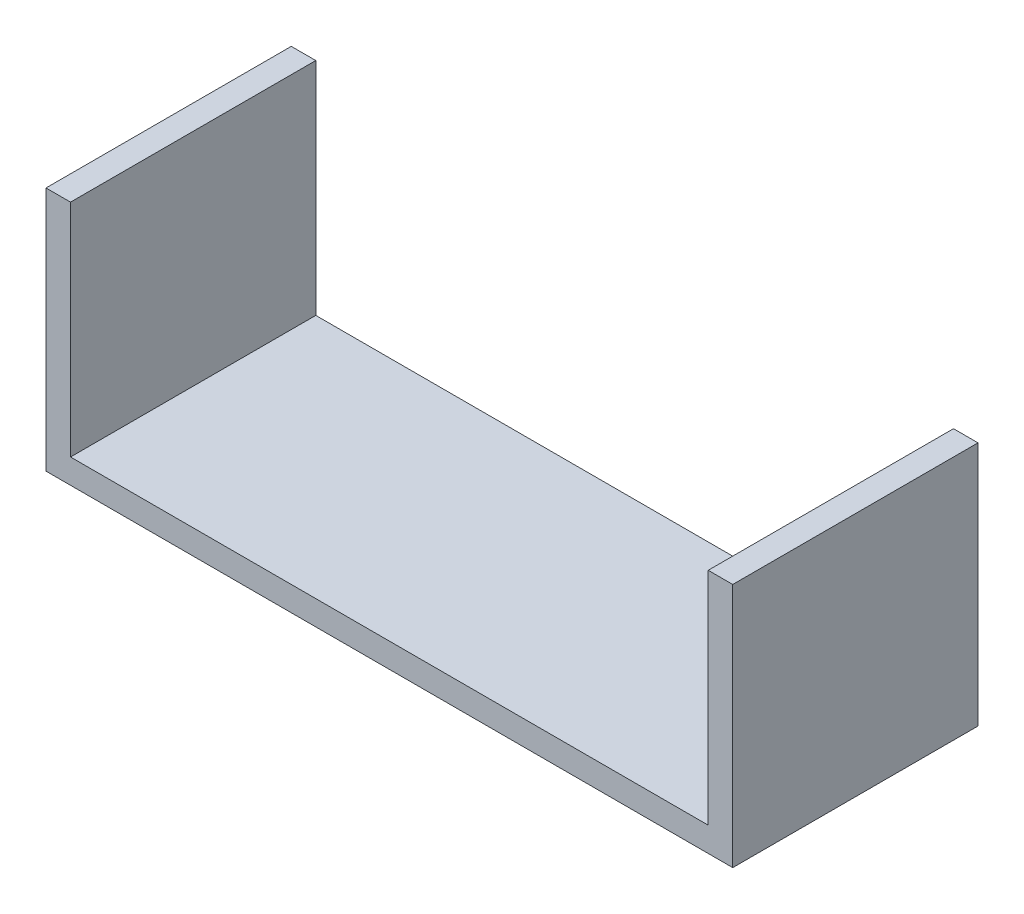
from build123d import *

# Parameters (mm, degrees)
RESSALTO_EXTRUS_O1_DEPTH = 50


with BuildPart() as part:
    # Esboço1 → Ressalto-extrusão1 (new body)
    with BuildSketch(Plane.XY):
        Polygon((0, 50), (0, 0), (140, 0), (140, 50), (135, 50), (135, 5), (5, 5), (5, 50), align=None)
    extrude(amount=RESSALTO_EXTRUS_O1_DEPTH)


solid = part.part
